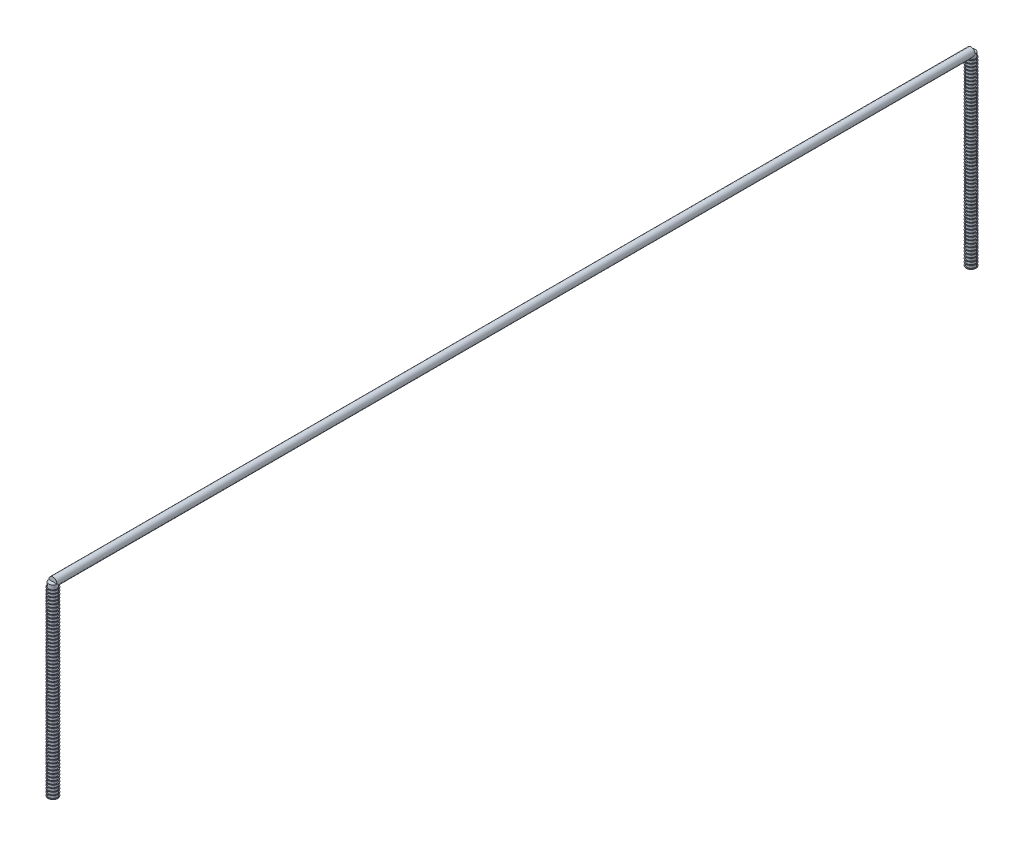
from build123d import *

# Parameters (mm, degrees)
CROQUIS1_R                = 40
SALIENTE_EXTRUIR1_DEPTH   = 9000
CROQUIS2_R                = 40
SALIENTE_EXTRUIR2_DEPTH   = 1816
CROQUIS3_R                = 47.824907403
SALIENTE_EXTRUIR3_DEPTH   = 5
MATRIZL1_COUNT            = 60
MATRIZL1_PITCH            = 30
MATRIZL2_COUNT            = 2
MATRIZL2_PITCH            = 9000
MATRIZL2_COPY_1_SKETCH_R  = 47.824907403
MATRIZL2_COPY_1_DEPTH     = 5
MATRIZL2_COPY_2_SKETCH_R  = 47.824907403
MATRIZL2_COPY_2_DEPTH     = 5
MATRIZL2_COPY_3_SKETCH_R  = 47.824907403
MATRIZL2_COPY_3_DEPTH     = 5
MATRIZL2_COPY_4_SKETCH_R  = 47.824907403
MATRIZL2_COPY_4_DEPTH     = 5
MATRIZL2_COPY_5_SKETCH_R  = 47.824907403
MATRIZL2_COPY_5_DEPTH     = 5
MATRIZL2_COPY_6_SKETCH_R  = 47.824907403
MATRIZL2_COPY_6_DEPTH     = 5
MATRIZL2_COPY_7_SKETCH_R  = 47.824907403
MATRIZL2_COPY_7_DEPTH     = 5
MATRIZL2_COPY_8_SKETCH_R  = 47.824907403
MATRIZL2_COPY_8_DEPTH     = 5
MATRIZL2_COPY_9_SKETCH_R  = 47.824907403
MATRIZL2_COPY_9_DEPTH     = 5
MATRIZL2_COPY_10_SKETCH_R = 47.824907403
MATRIZL2_COPY_10_DEPTH    = 5
MATRIZL2_COPY_11_SKETCH_R = 47.824907403
MATRIZL2_COPY_11_DEPTH    = 5
MATRIZL2_COPY_12_SKETCH_R = 47.824907403
MATRIZL2_COPY_12_DEPTH    = 5
MATRIZL2_COPY_13_SKETCH_R = 47.824907403
MATRIZL2_COPY_13_DEPTH    = 5
MATRIZL2_COPY_14_SKETCH_R = 47.824907403
MATRIZL2_COPY_14_DEPTH    = 5
MATRIZL2_COPY_15_SKETCH_R = 47.824907403
MATRIZL2_COPY_15_DEPTH    = 5
MATRIZL2_COPY_16_SKETCH_R = 47.824907403
MATRIZL2_COPY_16_DEPTH    = 5
MATRIZL2_COPY_17_SKETCH_R = 47.824907403
MATRIZL2_COPY_17_DEPTH    = 5
MATRIZL2_COPY_18_SKETCH_R = 47.824907403
MATRIZL2_COPY_18_DEPTH    = 5
MATRIZL2_COPY_19_SKETCH_R = 47.824907403
MATRIZL2_COPY_19_DEPTH    = 5
MATRIZL2_COPY_20_SKETCH_R = 47.824907403
MATRIZL2_COPY_20_DEPTH    = 5
MATRIZL2_COPY_21_SKETCH_R = 47.824907403
MATRIZL2_COPY_21_DEPTH    = 5
MATRIZL2_COPY_22_SKETCH_R = 47.824907403
MATRIZL2_COPY_22_DEPTH    = 5
MATRIZL2_COPY_23_SKETCH_R = 47.824907403
MATRIZL2_COPY_23_DEPTH    = 5
MATRIZL2_COPY_24_SKETCH_R = 47.824907403
MATRIZL2_COPY_24_DEPTH    = 5
MATRIZL2_COPY_25_SKETCH_R = 47.824907403
MATRIZL2_COPY_25_DEPTH    = 5
MATRIZL2_COPY_26_SKETCH_R = 47.824907403
MATRIZL2_COPY_26_DEPTH    = 5
MATRIZL2_COPY_27_SKETCH_R = 47.824907403
MATRIZL2_COPY_27_DEPTH    = 5
MATRIZL2_COPY_28_SKETCH_R = 47.824907403
MATRIZL2_COPY_28_DEPTH    = 5
MATRIZL2_COPY_29_SKETCH_R = 47.824907403
MATRIZL2_COPY_29_DEPTH    = 5
MATRIZL2_COPY_30_SKETCH_R = 47.824907403
MATRIZL2_COPY_30_DEPTH    = 5
MATRIZL2_COPY_31_SKETCH_R = 47.824907403
MATRIZL2_COPY_31_DEPTH    = 5
MATRIZL2_COPY_32_SKETCH_R = 47.824907403
MATRIZL2_COPY_32_DEPTH    = 5
MATRIZL2_COPY_33_SKETCH_R = 47.824907403
MATRIZL2_COPY_33_DEPTH    = 5
MATRIZL2_COPY_34_SKETCH_R = 47.824907403
MATRIZL2_COPY_34_DEPTH    = 5
MATRIZL2_COPY_35_SKETCH_R = 47.824907403
MATRIZL2_COPY_35_DEPTH    = 5
MATRIZL2_COPY_36_SKETCH_R = 47.824907403
MATRIZL2_COPY_36_DEPTH    = 5
MATRIZL2_COPY_37_SKETCH_R = 47.824907403
MATRIZL2_COPY_37_DEPTH    = 5
MATRIZL2_COPY_38_SKETCH_R = 47.824907403
MATRIZL2_COPY_38_DEPTH    = 5
MATRIZL2_COPY_39_SKETCH_R = 47.824907403
MATRIZL2_COPY_39_DEPTH    = 5
MATRIZL2_COPY_40_SKETCH_R = 47.824907403
MATRIZL2_COPY_40_DEPTH    = 5
MATRIZL2_COPY_41_SKETCH_R = 47.824907403
MATRIZL2_COPY_41_DEPTH    = 5
MATRIZL2_COPY_42_SKETCH_R = 47.824907403
MATRIZL2_COPY_42_DEPTH    = 5
MATRIZL2_COPY_43_SKETCH_R = 47.824907403
MATRIZL2_COPY_43_DEPTH    = 5
MATRIZL2_COPY_44_SKETCH_R = 47.824907403
MATRIZL2_COPY_44_DEPTH    = 5
MATRIZL2_COPY_45_SKETCH_R = 47.824907403
MATRIZL2_COPY_45_DEPTH    = 5
MATRIZL2_COPY_46_SKETCH_R = 47.824907403
MATRIZL2_COPY_46_DEPTH    = 5
MATRIZL2_COPY_47_SKETCH_R = 47.824907403
MATRIZL2_COPY_47_DEPTH    = 5
MATRIZL2_COPY_48_SKETCH_R = 47.824907403
MATRIZL2_COPY_48_DEPTH    = 5
MATRIZL2_COPY_49_SKETCH_R = 47.824907403
MATRIZL2_COPY_49_DEPTH    = 5
MATRIZL2_COPY_50_SKETCH_R = 47.824907403
MATRIZL2_COPY_50_DEPTH    = 5
MATRIZL2_COPY_51_SKETCH_R = 47.824907403
MATRIZL2_COPY_51_DEPTH    = 5
MATRIZL2_COPY_52_SKETCH_R = 47.824907403
MATRIZL2_COPY_52_DEPTH    = 5
MATRIZL2_COPY_53_SKETCH_R = 47.824907403
MATRIZL2_COPY_53_DEPTH    = 5
MATRIZL2_COPY_54_SKETCH_R = 47.824907403
MATRIZL2_COPY_54_DEPTH    = 5
MATRIZL2_COPY_55_SKETCH_R = 47.824907403
MATRIZL2_COPY_55_DEPTH    = 5
MATRIZL2_COPY_56_SKETCH_R = 47.824907403
MATRIZL2_COPY_56_DEPTH    = 5
MATRIZL2_COPY_57_SKETCH_R = 47.824907403
MATRIZL2_COPY_57_DEPTH    = 5
MATRIZL2_COPY_58_SKETCH_R = 47.824907403
MATRIZL2_COPY_58_DEPTH    = 5
MATRIZL2_COPY_59_SKETCH_R = 47.824907403
MATRIZL2_COPY_59_DEPTH    = 5


with BuildPart() as part:
    # Croquis1 → Saliente-Extruir1 (new body)
    with BuildSketch(Plane.XY):
        Circle(CROQUIS1_R)
    extrude(amount=SALIENTE_EXTRUIR1_DEPTH)

    # Croquis2 → Saliente-Extruir2 (add)
    with BuildSketch(Plane(origin=(0, 0, 0), x_dir=(1, 0, 0), z_dir=(0, 1, 0))):
        with Locations(Location((0, 0, 0), (0, 0, 270))):
            Circle(CROQUIS2_R)
        with Locations(Location((0, -9000, 0), (0, 0, 270))):
            Circle(CROQUIS2_R)
    extrude(amount=-SALIENTE_EXTRUIR2_DEPTH)

    # Croquis3 → Saliente-Extruir3 (add)
    with BuildSketch(Plane.XZ.offset(1816)):
        with Locations(Location((0, 9000, 0), (0, 0, 270))):
            Circle(CROQUIS3_R)
    saliente_extruir3 = extrude(amount=-SALIENTE_EXTRUIR3_DEPTH)

    # MatrizL1: Saliente-Extruir3 ×60
    with Locations(*[(0, i * MATRIZL1_PITCH, 0) for i in range(1, MATRIZL1_COUNT)]):
        add(saliente_extruir3)

    # MatrizL2: Saliente-Extruir3 ×2
    with Locations(*[(0, 0, -i * MATRIZL2_PITCH) for i in range(1, MATRIZL2_COUNT)]):
        add(saliente_extruir3)

    # MatrizL2 copy 1 sketch → MatrizL2 copy 1 (add)
    with BuildSketch(Plane(origin=(0, -1786, -9000), x_dir=(1, 0, 0), z_dir=(0, -1, 0))):
        with Locations(Location((0, 9000, 0), (0, 0, 270))):
            Circle(MATRIZL2_COPY_1_SKETCH_R)
    extrude(amount=-MATRIZL2_COPY_1_DEPTH)

    # MatrizL2 copy 2 sketch → MatrizL2 copy 2 (add)
    with BuildSketch(Plane(origin=(0, -1756, -9000), x_dir=(1, 0, 0), z_dir=(0, -1, 0))):
        with Locations(Location((0, 9000, 0), (0, 0, 270))):
            Circle(MATRIZL2_COPY_2_SKETCH_R)
    extrude(amount=-MATRIZL2_COPY_2_DEPTH)

    # MatrizL2 copy 3 sketch → MatrizL2 copy 3 (add)
    with BuildSketch(Plane(origin=(0, -1726, -9000), x_dir=(1, 0, 0), z_dir=(0, -1, 0))):
        with Locations(Location((0, 9000, 0), (0, 0, 270))):
            Circle(MATRIZL2_COPY_3_SKETCH_R)
    extrude(amount=-MATRIZL2_COPY_3_DEPTH)

    # MatrizL2 copy 4 sketch → MatrizL2 copy 4 (add)
    with BuildSketch(Plane(origin=(0, -1696, -9000), x_dir=(1, 0, 0), z_dir=(0, -1, 0))):
        with Locations(Location((0, 9000, 0), (0, 0, 270))):
            Circle(MATRIZL2_COPY_4_SKETCH_R)
    extrude(amount=-MATRIZL2_COPY_4_DEPTH)

    # MatrizL2 copy 5 sketch → MatrizL2 copy 5 (add)
    with BuildSketch(Plane(origin=(0, -1666, -9000), x_dir=(1, 0, 0), z_dir=(0, -1, 0))):
        with Locations(Location((0, 9000, 0), (0, 0, 270))):
            Circle(MATRIZL2_COPY_5_SKETCH_R)
    extrude(amount=-MATRIZL2_COPY_5_DEPTH)

    # MatrizL2 copy 6 sketch → MatrizL2 copy 6 (add)
    with BuildSketch(Plane(origin=(0, -1636, -9000), x_dir=(1, 0, 0), z_dir=(0, -1, 0))):
        with Locations(Location((0, 9000, 0), (0, 0, 270))):
            Circle(MATRIZL2_COPY_6_SKETCH_R)
    extrude(amount=-MATRIZL2_COPY_6_DEPTH)

    # MatrizL2 copy 7 sketch → MatrizL2 copy 7 (add)
    with BuildSketch(Plane(origin=(0, -1606, -9000), x_dir=(1, 0, 0), z_dir=(0, -1, 0))):
        with Locations(Location((0, 9000, 0), (0, 0, 270))):
            Circle(MATRIZL2_COPY_7_SKETCH_R)
    extrude(amount=-MATRIZL2_COPY_7_DEPTH)

    # MatrizL2 copy 8 sketch → MatrizL2 copy 8 (add)
    with BuildSketch(Plane(origin=(0, -1576, -9000), x_dir=(1, 0, 0), z_dir=(0, -1, 0))):
        with Locations(Location((0, 9000, 0), (0, 0, 270))):
            Circle(MATRIZL2_COPY_8_SKETCH_R)
    extrude(amount=-MATRIZL2_COPY_8_DEPTH)

    # MatrizL2 copy 9 sketch → MatrizL2 copy 9 (add)
    with BuildSketch(Plane(origin=(0, -1546, -9000), x_dir=(1, 0, 0), z_dir=(0, -1, 0))):
        with Locations(Location((0, 9000, 0), (0, 0, 270))):
            Circle(MATRIZL2_COPY_9_SKETCH_R)
    extrude(amount=-MATRIZL2_COPY_9_DEPTH)

    # MatrizL2 copy 10 sketch → MatrizL2 copy 10 (add)
    with BuildSketch(Plane(origin=(0, -1516, -9000), x_dir=(1, 0, 0), z_dir=(0, -1, 0))):
        with Locations(Location((0, 9000, 0), (0, 0, 270))):
            Circle(MATRIZL2_COPY_10_SKETCH_R)
    extrude(amount=-MATRIZL2_COPY_10_DEPTH)

    # MatrizL2 copy 11 sketch → MatrizL2 copy 11 (add)
    with BuildSketch(Plane(origin=(0, -1486, -9000), x_dir=(1, 0, 0), z_dir=(0, -1, 0))):
        with Locations(Location((0, 9000, 0), (0, 0, 270))):
            Circle(MATRIZL2_COPY_11_SKETCH_R)
    extrude(amount=-MATRIZL2_COPY_11_DEPTH)

    # MatrizL2 copy 12 sketch → MatrizL2 copy 12 (add)
    with BuildSketch(Plane(origin=(0, -1456, -9000), x_dir=(1, 0, 0), z_dir=(0, -1, 0))):
        with Locations(Location((0, 9000, 0), (0, 0, 270))):
            Circle(MATRIZL2_COPY_12_SKETCH_R)
    extrude(amount=-MATRIZL2_COPY_12_DEPTH)

    # MatrizL2 copy 13 sketch → MatrizL2 copy 13 (add)
    with BuildSketch(Plane(origin=(0, -1426, -9000), x_dir=(1, 0, 0), z_dir=(0, -1, 0))):
        with Locations(Location((0, 9000, 0), (0, 0, 270))):
            Circle(MATRIZL2_COPY_13_SKETCH_R)
    extrude(amount=-MATRIZL2_COPY_13_DEPTH)

    # MatrizL2 copy 14 sketch → MatrizL2 copy 14 (add)
    with BuildSketch(Plane(origin=(0, -1396, -9000), x_dir=(1, 0, 0), z_dir=(0, -1, 0))):
        with Locations(Location((0, 9000, 0), (0, 0, 270))):
            Circle(MATRIZL2_COPY_14_SKETCH_R)
    extrude(amount=-MATRIZL2_COPY_14_DEPTH)

    # MatrizL2 copy 15 sketch → MatrizL2 copy 15 (add)
    with BuildSketch(Plane(origin=(0, -1366, -9000), x_dir=(1, 0, 0), z_dir=(0, -1, 0))):
        with Locations(Location((0, 9000, 0), (0, 0, 270))):
            Circle(MATRIZL2_COPY_15_SKETCH_R)
    extrude(amount=-MATRIZL2_COPY_15_DEPTH)

    # MatrizL2 copy 16 sketch → MatrizL2 copy 16 (add)
    with BuildSketch(Plane(origin=(0, -1336, -9000), x_dir=(1, 0, 0), z_dir=(0, -1, 0))):
        with Locations(Location((0, 9000, 0), (0, 0, 270))):
            Circle(MATRIZL2_COPY_16_SKETCH_R)
    extrude(amount=-MATRIZL2_COPY_16_DEPTH)

    # MatrizL2 copy 17 sketch → MatrizL2 copy 17 (add)
    with BuildSketch(Plane(origin=(0, -1306, -9000), x_dir=(1, 0, 0), z_dir=(0, -1, 0))):
        with Locations(Location((0, 9000, 0), (0, 0, 270))):
            Circle(MATRIZL2_COPY_17_SKETCH_R)
    extrude(amount=-MATRIZL2_COPY_17_DEPTH)

    # MatrizL2 copy 18 sketch → MatrizL2 copy 18 (add)
    with BuildSketch(Plane(origin=(0, -1276, -9000), x_dir=(1, 0, 0), z_dir=(0, -1, 0))):
        with Locations(Location((0, 9000, 0), (0, 0, 270))):
            Circle(MATRIZL2_COPY_18_SKETCH_R)
    extrude(amount=-MATRIZL2_COPY_18_DEPTH)

    # MatrizL2 copy 19 sketch → MatrizL2 copy 19 (add)
    with BuildSketch(Plane(origin=(0, -1246, -9000), x_dir=(1, 0, 0), z_dir=(0, -1, 0))):
        with Locations(Location((0, 9000, 0), (0, 0, 270))):
            Circle(MATRIZL2_COPY_19_SKETCH_R)
    extrude(amount=-MATRIZL2_COPY_19_DEPTH)

    # MatrizL2 copy 20 sketch → MatrizL2 copy 20 (add)
    with BuildSketch(Plane(origin=(0, -1216, -9000), x_dir=(1, 0, 0), z_dir=(0, -1, 0))):
        with Locations(Location((0, 9000, 0), (0, 0, 270))):
            Circle(MATRIZL2_COPY_20_SKETCH_R)
    extrude(amount=-MATRIZL2_COPY_20_DEPTH)

    # MatrizL2 copy 21 sketch → MatrizL2 copy 21 (add)
    with BuildSketch(Plane(origin=(0, -1186, -9000), x_dir=(1, 0, 0), z_dir=(0, -1, 0))):
        with Locations(Location((0, 9000, 0), (0, 0, 270))):
            Circle(MATRIZL2_COPY_21_SKETCH_R)
    extrude(amount=-MATRIZL2_COPY_21_DEPTH)

    # MatrizL2 copy 22 sketch → MatrizL2 copy 22 (add)
    with BuildSketch(Plane(origin=(0, -1156, -9000), x_dir=(1, 0, 0), z_dir=(0, -1, 0))):
        with Locations(Location((0, 9000, 0), (0, 0, 270))):
            Circle(MATRIZL2_COPY_22_SKETCH_R)
    extrude(amount=-MATRIZL2_COPY_22_DEPTH)

    # MatrizL2 copy 23 sketch → MatrizL2 copy 23 (add)
    with BuildSketch(Plane(origin=(0, -1126, -9000), x_dir=(1, 0, 0), z_dir=(0, -1, 0))):
        with Locations(Location((0, 9000, 0), (0, 0, 270))):
            Circle(MATRIZL2_COPY_23_SKETCH_R)
    extrude(amount=-MATRIZL2_COPY_23_DEPTH)

    # MatrizL2 copy 24 sketch → MatrizL2 copy 24 (add)
    with BuildSketch(Plane(origin=(0, -1096, -9000), x_dir=(1, 0, 0), z_dir=(0, -1, 0))):
        with Locations(Location((0, 9000, 0), (0, 0, 270))):
            Circle(MATRIZL2_COPY_24_SKETCH_R)
    extrude(amount=-MATRIZL2_COPY_24_DEPTH)

    # MatrizL2 copy 25 sketch → MatrizL2 copy 25 (add)
    with BuildSketch(Plane(origin=(0, -1066, -9000), x_dir=(1, 0, 0), z_dir=(0, -1, 0))):
        with Locations(Location((0, 9000, 0), (0, 0, 270))):
            Circle(MATRIZL2_COPY_25_SKETCH_R)
    extrude(amount=-MATRIZL2_COPY_25_DEPTH)

    # MatrizL2 copy 26 sketch → MatrizL2 copy 26 (add)
    with BuildSketch(Plane(origin=(0, -1036, -9000), x_dir=(1, 0, 0), z_dir=(0, -1, 0))):
        with Locations(Location((0, 9000, 0), (0, 0, 270))):
            Circle(MATRIZL2_COPY_26_SKETCH_R)
    extrude(amount=-MATRIZL2_COPY_26_DEPTH)

    # MatrizL2 copy 27 sketch → MatrizL2 copy 27 (add)
    with BuildSketch(Plane(origin=(0, -1006, -9000), x_dir=(1, 0, 0), z_dir=(0, -1, 0))):
        with Locations(Location((0, 9000, 0), (0, 0, 270))):
            Circle(MATRIZL2_COPY_27_SKETCH_R)
    extrude(amount=-MATRIZL2_COPY_27_DEPTH)

    # MatrizL2 copy 28 sketch → MatrizL2 copy 28 (add)
    with BuildSketch(Plane(origin=(0, -976, -9000), x_dir=(1, 0, 0), z_dir=(0, -1, 0))):
        with Locations(Location((0, 9000, 0), (0, 0, 270))):
            Circle(MATRIZL2_COPY_28_SKETCH_R)
    extrude(amount=-MATRIZL2_COPY_28_DEPTH)

    # MatrizL2 copy 29 sketch → MatrizL2 copy 29 (add)
    with BuildSketch(Plane(origin=(0, -946, -9000), x_dir=(1, 0, 0), z_dir=(0, -1, 0))):
        with Locations(Location((0, 9000, 0), (0, 0, 270))):
            Circle(MATRIZL2_COPY_29_SKETCH_R)
    extrude(amount=-MATRIZL2_COPY_29_DEPTH)

    # MatrizL2 copy 30 sketch → MatrizL2 copy 30 (add)
    with BuildSketch(Plane(origin=(0, -916, -9000), x_dir=(1, 0, 0), z_dir=(0, -1, 0))):
        with Locations(Location((0, 9000, 0), (0, 0, 270))):
            Circle(MATRIZL2_COPY_30_SKETCH_R)
    extrude(amount=-MATRIZL2_COPY_30_DEPTH)

    # MatrizL2 copy 31 sketch → MatrizL2 copy 31 (add)
    with BuildSketch(Plane(origin=(0, -886, -9000), x_dir=(1, 0, 0), z_dir=(0, -1, 0))):
        with Locations(Location((0, 9000, 0), (0, 0, 270))):
            Circle(MATRIZL2_COPY_31_SKETCH_R)
    extrude(amount=-MATRIZL2_COPY_31_DEPTH)

    # MatrizL2 copy 32 sketch → MatrizL2 copy 32 (add)
    with BuildSketch(Plane(origin=(0, -856, -9000), x_dir=(1, 0, 0), z_dir=(0, -1, 0))):
        with Locations(Location((0, 9000, 0), (0, 0, 270))):
            Circle(MATRIZL2_COPY_32_SKETCH_R)
    extrude(amount=-MATRIZL2_COPY_32_DEPTH)

    # MatrizL2 copy 33 sketch → MatrizL2 copy 33 (add)
    with BuildSketch(Plane(origin=(0, -826, -9000), x_dir=(1, 0, 0), z_dir=(0, -1, 0))):
        with Locations(Location((0, 9000, 0), (0, 0, 270))):
            Circle(MATRIZL2_COPY_33_SKETCH_R)
    extrude(amount=-MATRIZL2_COPY_33_DEPTH)

    # MatrizL2 copy 34 sketch → MatrizL2 copy 34 (add)
    with BuildSketch(Plane(origin=(0, -796, -9000), x_dir=(1, 0, 0), z_dir=(0, -1, 0))):
        with Locations(Location((0, 9000, 0), (0, 0, 270))):
            Circle(MATRIZL2_COPY_34_SKETCH_R)
    extrude(amount=-MATRIZL2_COPY_34_DEPTH)

    # MatrizL2 copy 35 sketch → MatrizL2 copy 35 (add)
    with BuildSketch(Plane(origin=(0, -766, -9000), x_dir=(1, 0, 0), z_dir=(0, -1, 0))):
        with Locations(Location((0, 9000, 0), (0, 0, 270))):
            Circle(MATRIZL2_COPY_35_SKETCH_R)
    extrude(amount=-MATRIZL2_COPY_35_DEPTH)

    # MatrizL2 copy 36 sketch → MatrizL2 copy 36 (add)
    with BuildSketch(Plane(origin=(0, -736, -9000), x_dir=(1, 0, 0), z_dir=(0, -1, 0))):
        with Locations(Location((0, 9000, 0), (0, 0, 270))):
            Circle(MATRIZL2_COPY_36_SKETCH_R)
    extrude(amount=-MATRIZL2_COPY_36_DEPTH)

    # MatrizL2 copy 37 sketch → MatrizL2 copy 37 (add)
    with BuildSketch(Plane(origin=(0, -706, -9000), x_dir=(1, 0, 0), z_dir=(0, -1, 0))):
        with Locations(Location((0, 9000, 0), (0, 0, 270))):
            Circle(MATRIZL2_COPY_37_SKETCH_R)
    extrude(amount=-MATRIZL2_COPY_37_DEPTH)

    # MatrizL2 copy 38 sketch → MatrizL2 copy 38 (add)
    with BuildSketch(Plane(origin=(0, -676, -9000), x_dir=(1, 0, 0), z_dir=(0, -1, 0))):
        with Locations(Location((0, 9000, 0), (0, 0, 270))):
            Circle(MATRIZL2_COPY_38_SKETCH_R)
    extrude(amount=-MATRIZL2_COPY_38_DEPTH)

    # MatrizL2 copy 39 sketch → MatrizL2 copy 39 (add)
    with BuildSketch(Plane(origin=(0, -646, -9000), x_dir=(1, 0, 0), z_dir=(0, -1, 0))):
        with Locations(Location((0, 9000, 0), (0, 0, 270))):
            Circle(MATRIZL2_COPY_39_SKETCH_R)
    extrude(amount=-MATRIZL2_COPY_39_DEPTH)

    # MatrizL2 copy 40 sketch → MatrizL2 copy 40 (add)
    with BuildSketch(Plane(origin=(0, -616, -9000), x_dir=(1, 0, 0), z_dir=(0, -1, 0))):
        with Locations(Location((0, 9000, 0), (0, 0, 270))):
            Circle(MATRIZL2_COPY_40_SKETCH_R)
    extrude(amount=-MATRIZL2_COPY_40_DEPTH)

    # MatrizL2 copy 41 sketch → MatrizL2 copy 41 (add)
    with BuildSketch(Plane(origin=(0, -586, -9000), x_dir=(1, 0, 0), z_dir=(0, -1, 0))):
        with Locations(Location((0, 9000, 0), (0, 0, 270))):
            Circle(MATRIZL2_COPY_41_SKETCH_R)
    extrude(amount=-MATRIZL2_COPY_41_DEPTH)

    # MatrizL2 copy 42 sketch → MatrizL2 copy 42 (add)
    with BuildSketch(Plane(origin=(0, -556, -9000), x_dir=(1, 0, 0), z_dir=(0, -1, 0))):
        with Locations(Location((0, 9000, 0), (0, 0, 270))):
            Circle(MATRIZL2_COPY_42_SKETCH_R)
    extrude(amount=-MATRIZL2_COPY_42_DEPTH)

    # MatrizL2 copy 43 sketch → MatrizL2 copy 43 (add)
    with BuildSketch(Plane(origin=(0, -526, -9000), x_dir=(1, 0, 0), z_dir=(0, -1, 0))):
        with Locations(Location((0, 9000, 0), (0, 0, 270))):
            Circle(MATRIZL2_COPY_43_SKETCH_R)
    extrude(amount=-MATRIZL2_COPY_43_DEPTH)

    # MatrizL2 copy 44 sketch → MatrizL2 copy 44 (add)
    with BuildSketch(Plane(origin=(0, -496, -9000), x_dir=(1, 0, 0), z_dir=(0, -1, 0))):
        with Locations(Location((0, 9000, 0), (0, 0, 270))):
            Circle(MATRIZL2_COPY_44_SKETCH_R)
    extrude(amount=-MATRIZL2_COPY_44_DEPTH)

    # MatrizL2 copy 45 sketch → MatrizL2 copy 45 (add)
    with BuildSketch(Plane(origin=(0, -466, -9000), x_dir=(1, 0, 0), z_dir=(0, -1, 0))):
        with Locations(Location((0, 9000, 0), (0, 0, 270))):
            Circle(MATRIZL2_COPY_45_SKETCH_R)
    extrude(amount=-MATRIZL2_COPY_45_DEPTH)

    # MatrizL2 copy 46 sketch → MatrizL2 copy 46 (add)
    with BuildSketch(Plane(origin=(0, -436, -9000), x_dir=(1, 0, 0), z_dir=(0, -1, 0))):
        with Locations(Location((0, 9000, 0), (0, 0, 270))):
            Circle(MATRIZL2_COPY_46_SKETCH_R)
    extrude(amount=-MATRIZL2_COPY_46_DEPTH)

    # MatrizL2 copy 47 sketch → MatrizL2 copy 47 (add)
    with BuildSketch(Plane(origin=(0, -406, -9000), x_dir=(1, 0, 0), z_dir=(0, -1, 0))):
        with Locations(Location((0, 9000, 0), (0, 0, 270))):
            Circle(MATRIZL2_COPY_47_SKETCH_R)
    extrude(amount=-MATRIZL2_COPY_47_DEPTH)

    # MatrizL2 copy 48 sketch → MatrizL2 copy 48 (add)
    with BuildSketch(Plane(origin=(0, -376, -9000), x_dir=(1, 0, 0), z_dir=(0, -1, 0))):
        with Locations(Location((0, 9000, 0), (0, 0, 270))):
            Circle(MATRIZL2_COPY_48_SKETCH_R)
    extrude(amount=-MATRIZL2_COPY_48_DEPTH)

    # MatrizL2 copy 49 sketch → MatrizL2 copy 49 (add)
    with BuildSketch(Plane(origin=(0, -346, -9000), x_dir=(1, 0, 0), z_dir=(0, -1, 0))):
        with Locations(Location((0, 9000, 0), (0, 0, 270))):
            Circle(MATRIZL2_COPY_49_SKETCH_R)
    extrude(amount=-MATRIZL2_COPY_49_DEPTH)

    # MatrizL2 copy 50 sketch → MatrizL2 copy 50 (add)
    with BuildSketch(Plane(origin=(0, -316, -9000), x_dir=(1, 0, 0), z_dir=(0, -1, 0))):
        with Locations(Location((0, 9000, 0), (0, 0, 270))):
            Circle(MATRIZL2_COPY_50_SKETCH_R)
    extrude(amount=-MATRIZL2_COPY_50_DEPTH)

    # MatrizL2 copy 51 sketch → MatrizL2 copy 51 (add)
    with BuildSketch(Plane(origin=(0, -286, -9000), x_dir=(1, 0, 0), z_dir=(0, -1, 0))):
        with Locations(Location((0, 9000, 0), (0, 0, 270))):
            Circle(MATRIZL2_COPY_51_SKETCH_R)
    extrude(amount=-MATRIZL2_COPY_51_DEPTH)

    # MatrizL2 copy 52 sketch → MatrizL2 copy 52 (add)
    with BuildSketch(Plane(origin=(0, -256, -9000), x_dir=(1, 0, 0), z_dir=(0, -1, 0))):
        with Locations(Location((0, 9000, 0), (0, 0, 270))):
            Circle(MATRIZL2_COPY_52_SKETCH_R)
    extrude(amount=-MATRIZL2_COPY_52_DEPTH)

    # MatrizL2 copy 53 sketch → MatrizL2 copy 53 (add)
    with BuildSketch(Plane(origin=(0, -226, -9000), x_dir=(1, 0, 0), z_dir=(0, -1, 0))):
        with Locations(Location((0, 9000, 0), (0, 0, 270))):
            Circle(MATRIZL2_COPY_53_SKETCH_R)
    extrude(amount=-MATRIZL2_COPY_53_DEPTH)

    # MatrizL2 copy 54 sketch → MatrizL2 copy 54 (add)
    with BuildSketch(Plane(origin=(0, -196, -9000), x_dir=(1, 0, 0), z_dir=(0, -1, 0))):
        with Locations(Location((0, 9000, 0), (0, 0, 270))):
            Circle(MATRIZL2_COPY_54_SKETCH_R)
    extrude(amount=-MATRIZL2_COPY_54_DEPTH)

    # MatrizL2 copy 55 sketch → MatrizL2 copy 55 (add)
    with BuildSketch(Plane(origin=(0, -166, -9000), x_dir=(1, 0, 0), z_dir=(0, -1, 0))):
        with Locations(Location((0, 9000, 0), (0, 0, 270))):
            Circle(MATRIZL2_COPY_55_SKETCH_R)
    extrude(amount=-MATRIZL2_COPY_55_DEPTH)

    # MatrizL2 copy 56 sketch → MatrizL2 copy 56 (add)
    with BuildSketch(Plane(origin=(0, -136, -9000), x_dir=(1, 0, 0), z_dir=(0, -1, 0))):
        with Locations(Location((0, 9000, 0), (0, 0, 270))):
            Circle(MATRIZL2_COPY_56_SKETCH_R)
    extrude(amount=-MATRIZL2_COPY_56_DEPTH)

    # MatrizL2 copy 57 sketch → MatrizL2 copy 57 (add)
    with BuildSketch(Plane(origin=(0, -106, -9000), x_dir=(1, 0, 0), z_dir=(0, -1, 0))):
        with Locations(Location((0, 9000, 0), (0, 0, 270))):
            Circle(MATRIZL2_COPY_57_SKETCH_R)
    extrude(amount=-MATRIZL2_COPY_57_DEPTH)

    # MatrizL2 copy 58 sketch → MatrizL2 copy 58 (add)
    with BuildSketch(Plane(origin=(0, -76, -9000), x_dir=(1, 0, 0), z_dir=(0, -1, 0))):
        with Locations(Location((0, 9000, 0), (0, 0, 270))):
            Circle(MATRIZL2_COPY_58_SKETCH_R)
    extrude(amount=-MATRIZL2_COPY_58_DEPTH)

    # MatrizL2 copy 59 sketch → MatrizL2 copy 59 (add)
    with BuildSketch(Plane(origin=(0, -46, -9000), x_dir=(1, 0, 0), z_dir=(0, -1, 0))):
        with Locations(Location((0, 9000, 0), (0, 0, 270))):
            Circle(MATRIZL2_COPY_59_SKETCH_R)
    extrude(amount=-MATRIZL2_COPY_59_DEPTH)


solid = part.part
